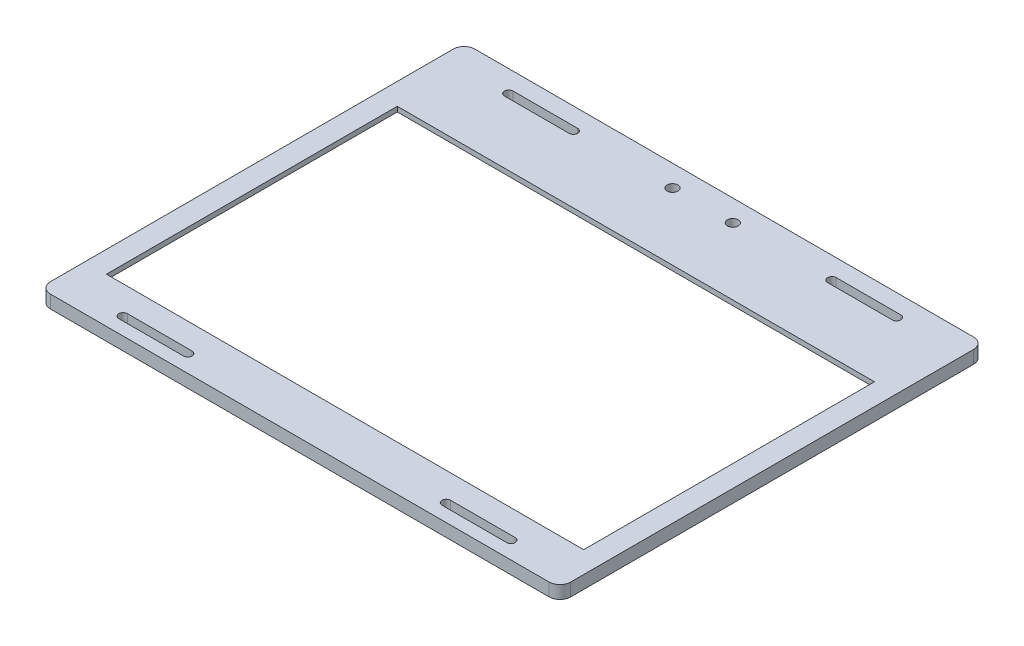
from build123d import *

# Parameters (mm, degrees)
SKETCH1_W               = 241.5
SKETCH1_H               = 197
SKETCH1_R               = 2.5
BOSS_EXTRUDE1_DEPTH     = 6
SKETCH1_5_W             = 229.5
SKETCH1_5_H             = 150
CUT_EXTRUDE1_DEPTH      = 3.7
FILLET1_R               = 5
CUT_EXTRUDE3_DEPTH      = 158.465083431
CUT_EXTRUDE3_DEPTH_BACK = 158.465083431


with BuildPart() as part:
    # Sketch1 → Boss-Extrude1 (new body)
    with BuildSketch(Plane(origin=(0, 0, 0), x_dir=(1, 0, 0), z_dir=(0, 1, 0))):
        with Locations((0, 2.5)):
            Rectangle(SKETCH1_W, SKETCH1_H)
        with BuildLine():
            ThreePointArc((90, 93), (92, 91), (90, 89))
            Line((90, 89), (60, 89))
            ThreePointArc((60, 89), (58, 91), (60, 93))
            Line((60, 93), (90, 93))
        make_face(mode=Mode.SUBTRACT)
        with BuildLine():
            ThreePointArc((-90, 89), (-92, 91), (-90, 93))
            Line((-90, 93), (-60, 93))
            ThreePointArc((-60, 93), (-58, 91), (-60, 89))
            Line((-60, 89), (-90, 89))
        make_face(mode=Mode.SUBTRACT)
        with Locations(Location((-14, 91, 0), (0, 0, 270))):
            Circle(SKETCH1_R, mode=Mode.SUBTRACT)
        with Locations(Location((14, 91, 0), (0, 0, 270))):
            Circle(SKETCH1_R, mode=Mode.SUBTRACT)
        with BuildLine():
            ThreePointArc((90, -86), (92, -88), (90, -90))
            Line((90, -90), (60, -90))
            ThreePointArc((60, -90), (58, -88), (60, -86))
            Line((60, -86), (90, -86))
        make_face(mode=Mode.SUBTRACT)
        with BuildLine():
            ThreePointArc((-90, -90), (-92, -88), (-90, -86))
            Line((-90, -86), (-60, -86))
            ThreePointArc((-60, -86), (-58, -88), (-60, -90))
            Line((-60, -90), (-90, -90))
        make_face(mode=Mode.SUBTRACT)
    extrude(amount=BOSS_EXTRUDE1_DEPTH)

    # Sketch1<5> → Cut-Extrude1 (cut)
    with BuildSketch(Plane(origin=(0, 0, 0), x_dir=(1, 0, 0), z_dir=(0, 1, 0))):
        Rectangle(SKETCH1_5_W, SKETCH1_5_H)
    extrude(amount=CUT_EXTRUDE1_DEPTH, mode=Mode.SUBTRACT)

    # Fillet1
    fillet1_edges = [part.edges().sort_by_distance(p)[0] for p in [
        (-120.75, 3, -101),
        (120.75, 3, -101),
        (-120.75, 3, 96),
        (120.75, 3, 96),
    ]]
    fillet(fillet1_edges, radius=FILLET1_R)

    # Sketch2 → Cut-Extrude3 (cut, two sides: drawn at the far end of the back side and taken through both)
    with BuildSketch(Plane.XZ.offset(-3.7).offset(-CUT_EXTRUDE3_DEPTH_BACK)):
        Polygon((94.75, -60), (110.75, -60), (110.75, 75), (94.75, 75), (-94.75, 75), (-110.75, 75), (-110.75, -60), align=None)
    extrude(amount=CUT_EXTRUDE3_DEPTH + CUT_EXTRUDE3_DEPTH_BACK, mode=Mode.SUBTRACT)


solid = part.part
